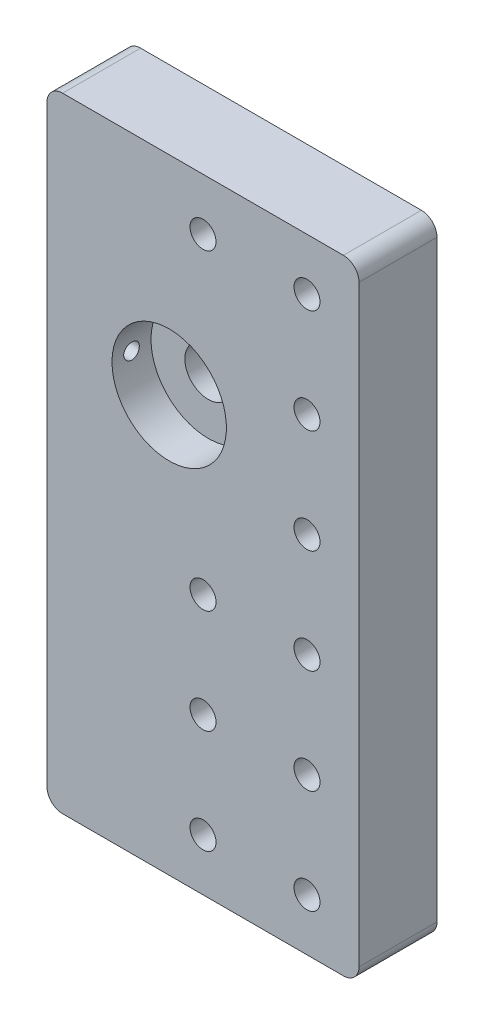
from build123d import *

# Parameters (mm, degrees)
SKETCH1_W           = 60
SKETCH1_H           = 120
SKETCH1_R           = 2.5
BOSS_EXTRUDE1_DEPTH = 15
FILLET1_R           = 3
SKETCH2_R           = 4.5
CUT_EXTRUDE1_DEPTH  = 136
SKETCH2_3_R         = 11
SKETCH2_3_R_2       = 4.5
CUT_EXTRUDE2_DEPTH  = 7.5
CUT_EXTRUDE3_REACH  = 137
SKETCH3_R           = 1.5


with BuildPart() as part:
    # Sketch1 → Boss-Extrude1 (new body)
    with BuildSketch(Plane.XY):
        with Locations((30, 60)):
            Rectangle(SKETCH1_W, SKETCH1_H)
        with Locations((10, 110)):
            Circle(SKETCH1_R, mode=Mode.SUBTRACT)
        with Locations((30, 110)):
            Circle(SKETCH1_R, mode=Mode.SUBTRACT)
        with Locations((10, 90)):
            Circle(SKETCH1_R, mode=Mode.SUBTRACT)
        with Locations((10, 70)):
            Circle(SKETCH1_R, mode=Mode.SUBTRACT)
        with Locations((10, 10)):
            Circle(SKETCH1_R, mode=Mode.SUBTRACT)
        with Locations((30, 10)):
            Circle(SKETCH1_R, mode=Mode.SUBTRACT)
        with Locations((30, 50)):
            Circle(SKETCH1_R, mode=Mode.SUBTRACT)
        with Locations((10, 50)):
            Circle(SKETCH1_R, mode=Mode.SUBTRACT)
        with Locations((10, 30)):
            Circle(SKETCH1_R, mode=Mode.SUBTRACT)
        with Locations((30, 30)):
            Circle(SKETCH1_R, mode=Mode.SUBTRACT)
    extrude(amount=BOSS_EXTRUDE1_DEPTH)

    # Fillet1
    fillet1_edges = [part.edges().sort_by_distance(p)[0] for p in [
        (0, 0, 7.5),
        (60, 0, 7.5),
        (0, 120, 7.5),
        (60, 120, 7.5),
    ]]
    fillet(fillet1_edges, radius=FILLET1_R)

    # Sketch2 → Cut-Extrude1 (cut, through all)
    with BuildSketch(Plane.XY.offset(15)):
        with Locations((36.5, 80)):
            Circle(SKETCH2_R)
    extrude(amount=-CUT_EXTRUDE1_DEPTH, mode=Mode.SUBTRACT)

    # Sketch2<3> → Cut-Extrude2 (cut)
    with BuildSketch(Plane.XY.offset(15)):
        with Locations((36.5, 80)):
            Circle(SKETCH2_3_R)
        with Locations((36.5, 80)):
            Circle(SKETCH2_3_R_2, mode=Mode.SUBTRACT)
    extrude(amount=-CUT_EXTRUDE2_DEPTH, mode=Mode.SUBTRACT)


with BuildPart() as body_2:
    # Mirror1: mirrored copy
    add(part.part.mirror(Plane(origin=(60, 0, 15), x_dir=(0, 0, 1), z_dir=(-1, 0, 0))))

    # Sketch3 → Cut-Extrude3 (cut, up to next)
    with BuildSketch(Plane.ZY.offset(-60), mode=Mode.PRIVATE) as cut_extrude3_sk1:
        with Locations((11.25, 80)):
            Circle(SKETCH3_R)
    cut_extrude3_tool1 = extrude(cut_extrude3_sk1.sketch, amount=-CUT_EXTRUDE3_REACH, mode=Mode.PRIVATE) & body_2.part
    add(cut_extrude3_tool1.solids().sort_by_distance((60, 80, 11.25))[0], mode=Mode.SUBTRACT)


solid = body_2.part
